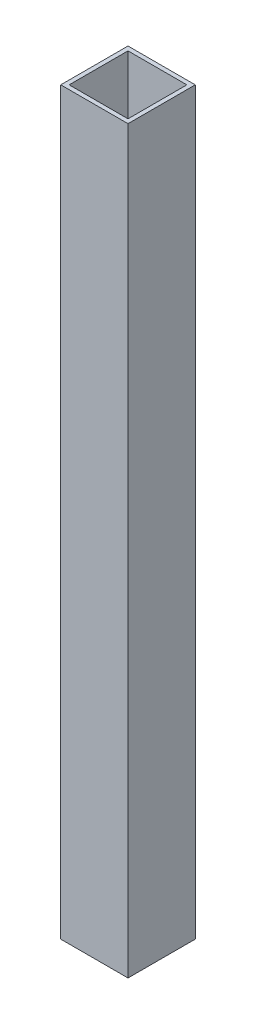
from build123d import *

# Parameters (mm, degrees)
SKETCH1_W           = 25.4
SKETCH1_H           = 25.4
SKETCH1_W_2         = 22.225
SKETCH1_H_2         = 22.225
BOSS_EXTRUDE1_DEPTH = 279.4


with BuildPart() as part:
    # Sketch1 → Boss-Extrude1 (new body)
    with BuildSketch(Plane(origin=(0, 0, 0), x_dir=(1, 0, 0), z_dir=(0, 1, 0))):
        Rectangle(SKETCH1_W, SKETCH1_H)
        Rectangle(SKETCH1_W_2, SKETCH1_H_2, mode=Mode.SUBTRACT)
    extrude(amount=BOSS_EXTRUDE1_DEPTH)


solid = part.part
